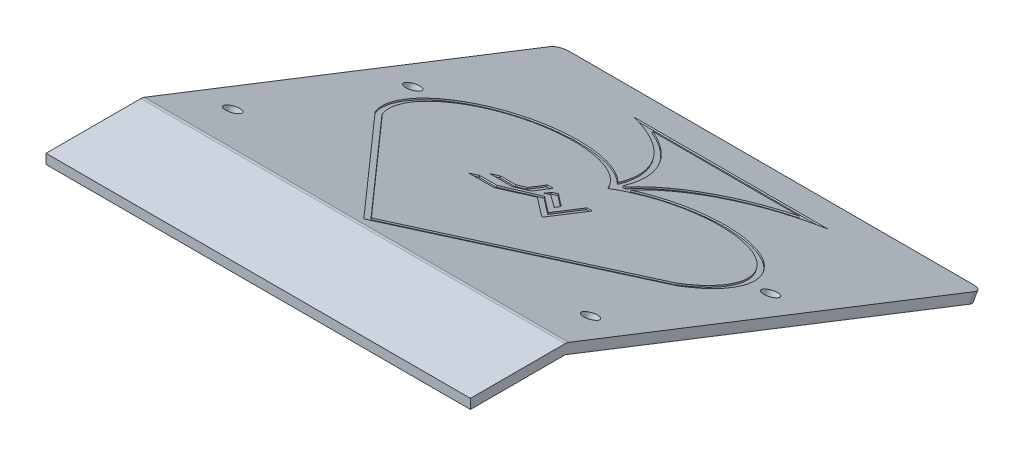
from build123d import *

# Parameters (mm, degrees)
RESSALTO_EXTRUS_O1_DEPTH = 87.78
ESBO_O2_R                = 1.55
CORTE_EXTRUS_O1_DEPTH    = 2.000797456
FILETE1_R                = 2
FILETE2_R                = 2
CORTE_EXTRUS_O2_DEPTH    = 0.3
CORTE_EXTRUS_O3_DEPTH    = 0.3


with BuildPart() as part:
    # Esboço1 → Ressalto-extrusão1 (new body)
    with BuildSketch(Plane(origin=(0, 0, 0), x_dir=(0, 0, -1), z_dir=(1, 0, 0))):
        Polygon((0, 2), (19.99, 2), (106.12, -31.745348352), (105.11, -33.498517173), (19.61, 0), (0, 0), align=None)
    extrude(amount=RESSALTO_EXTRUS_O1_DEPTH)

    # Esboço2 → Corte-extrusão1 (cut)
    with BuildSketch(Plane(origin=(0, 8.523589674, -3.33950427), x_dir=(1, 0, 0), z_dir=(0, 0.9310875040982999, -0.36479591515256676))):
        with Locations(Location((80.80000159, 30.587577749, 0), (0, 0, 270))):
            Circle(ESBO_O2_R)
        with Locations(Location((6.80000159, 30.587577749, 0), (0, 0, 270))):
            Circle(ESBO_O2_R)
        with Locations(Location((80.80000159, 70.587577749, 0), (0, 0, 270))):
            Circle(ESBO_O2_R)
        with Locations(Location((6.80000159, 70.587577749, 0), (0, 0, 270))):
            Circle(ESBO_O2_R)
    extrude(amount=-CORTE_EXTRUS_O1_DEPTH, mode=Mode.SUBTRACT)

    # Filete1
    filete1_edges = [part.edges().sort_by_distance(p)[0] for p in [
        (87.78, -32.621932763, -105.615),
        (0, -32.621932763, -105.615),
    ]]
    fillet(filete1_edges, radius=FILETE1_R)

    # Filete2
    filete2_edges = [part.edges().sort_by_distance(p)[0] for p in [
        (43.89, 2, -19.99),
    ]]
    fillet(filete2_edges, radius=FILETE2_R)

    # Esboço5 → Corte-extrusão2 (cut)
    with BuildSketch(Plane(origin=(0, 8.523589674, -3.33950427), x_dir=(1, 0, 0), z_dir=(0, 0.9310875040982999, -0.36479591515256676))):
        with BuildLine():
            ThreePointArc((42.554958064, 77.750017871), (36.485484967, 92.178478749), (23.83842585, 101.401866557))
            Line((23.83842585, 101.401866557), (63.94157415, 101.401866557))
            ThreePointArc((63.94157415, 101.401866557), (51.294515033, 92.178478749), (45.225041936, 77.750017871))
            ThreePointArc((45.225041936, 77.750017871), (70.022049562, 80.317662999), (75.100625445, 55.910851333))
            Line((75.100625445, 55.910851333), (43.890007976, 19.871588801))
            Line((43.890007976, 19.871588801), (12.680587753, 55.908777517))
            ThreePointArc((12.680587753, 55.908777517), (17.756980644, 80.316954028), (42.554958064, 77.750017871))
        make_face()
        with BuildLine():
            Line((59.045444566, 100.301866557), (28.734555434, 100.301866557))
            ThreePointArc((28.734555434, 100.301866557), (38.853768409, 90.783324538), (43.663553306, 77.750017871))
            Line((43.663553306, 77.750017871), (44.116446694, 77.750017871))
            ThreePointArc((44.116446694, 77.750017871), (48.926231591, 90.783324538), (59.045444566, 100.301866557))
        make_face(mode=Mode.SUBTRACT)
        with BuildLine():
            ThreePointArc((43.89, 74.051866557), (19.984051861, 80.457020374), (13.579692383, 56.550859421))
            Line((13.579692383, 56.550859421), (43.89, 21.551866557))
            Line((43.89, 21.551866557), (74.201470581, 56.552873732))
            ThreePointArc((74.201470581, 56.552873732), (67.794940984, 80.457601856), (43.89, 74.051866557))
        make_face(mode=Mode.SUBTRACT)
    extrude(amount=-CORTE_EXTRUS_O2_DEPTH, mode=Mode.SUBTRACT)

    # Logo_MF → Corte-extrusão3 (cut)
    with BuildSketch(Plane(origin=(0, 8.523589674, -3.33950427), x_dir=(1, 0, 0), z_dir=(0, 0.9310875040982999, -0.36479591515256676))):
        Polygon((49.962573353, 64.155016633), (48.8289818, 64.155016633), (48.8289818, 55.535121255), (43.89, 60.021613531), (38.906920465, 54.778752605), (35.388063353, 54.778752605), (34.260081833, 53.537007416), (39.45058041, 53.537007416), (43.888190467, 58.422176933), (49.962573353, 52.904304422), align=None)
        Polygon((47.520333519, 58.27431755), (47.520333519, 59.844814175), (43.63988582, 63.369750961), (42.9589818, 62.620173706), (42.9589818, 60.900053981), (43.641004718, 61.650862981), align=None)
        Polygon((41.8589818, 64.155016633), (41.8589818, 59.312995139), (39.859003533, 57.208752605), (35.175514937, 57.208752605), (36.327896381, 58.421210806), (39.450099751, 58.421210806), (40.643954402, 59.677304324), (40.643954402, 64.155016633), align=None)
    extrude(amount=-CORTE_EXTRUS_O3_DEPTH, mode=Mode.SUBTRACT)


solid = part.part
